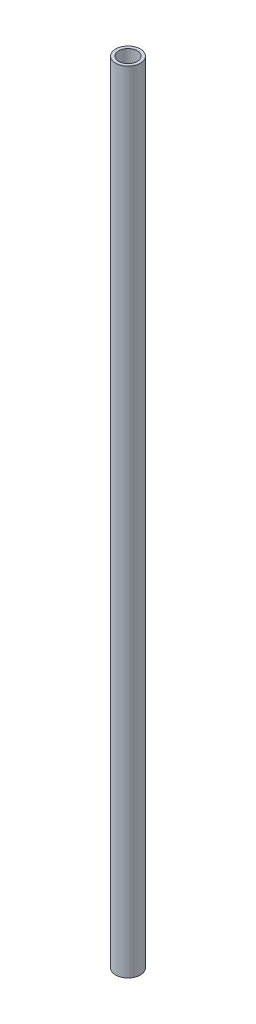
from build123d import *

# Parameters (mm, degrees)
SKETCH1_R           = 1.5875
BOSS_EXTRUDE1_DEPTH = 101.6
SKETCH2_R           = 1.190625
CUT_EXTRUDE1_DEPTH  = 102.62480166


with BuildPart() as part:
    # Sketch1 → Boss-Extrude1 (new body)
    with BuildSketch(Plane(origin=(0, 0, 0), x_dir=(1, 0, 0), z_dir=(0, 1, 0))):
        with Locations(Location((0, 0, 0), (0, 0, 270))):
            Circle(SKETCH1_R)
    extrude(amount=BOSS_EXTRUDE1_DEPTH)

    # Sketch2 → Cut-Extrude1 (cut, through all)
    with BuildSketch(Plane(origin=(0, 101.6, 0), x_dir=(1, 0, 0), z_dir=(0, 1, 0))):
        with Locations(Location((0, 0, 0), (0, 0, 270))):
            Circle(SKETCH2_R)
    extrude(amount=-CUT_EXTRUDE1_DEPTH, mode=Mode.SUBTRACT)


solid = part.part
